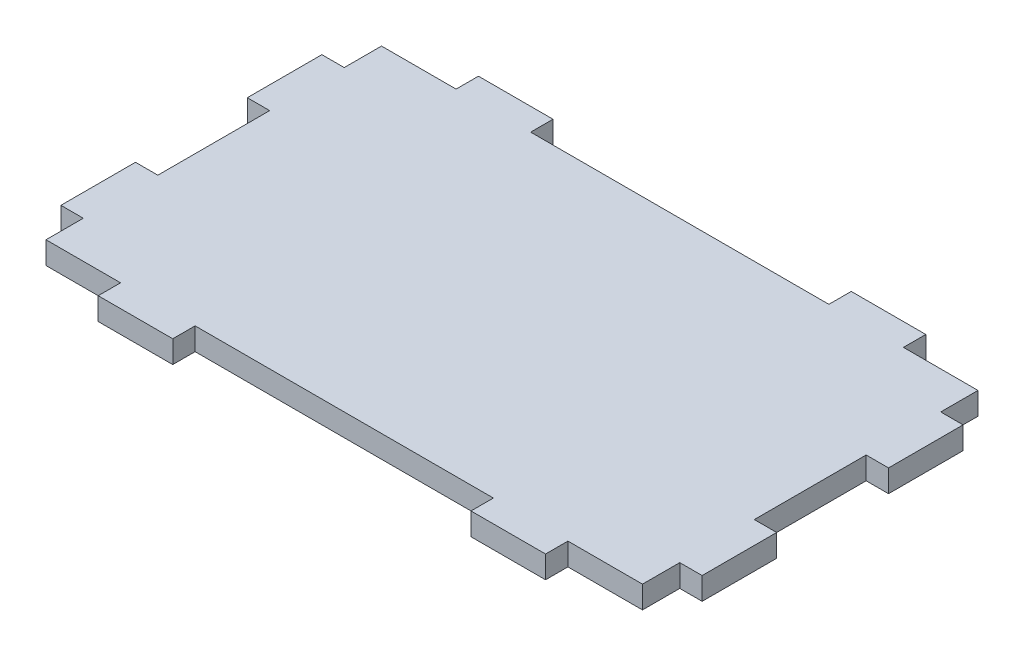
from build123d import *

# Parameters (mm, degrees)
BOSS_EXTRUDE1_DEPTH = 3


with BuildPart() as part:
    # Sketch1 → Boss-Extrude1 (new body)
    with BuildSketch(Plane(origin=(0, 0, 0), x_dir=(1, 0, 0), z_dir=(0, 1, 0))):
        Polygon((0, 0), (10, 0), (10, -3), (20, -3), (20, 0), (60, 0), (60, -3), (70, -3), (70, 0), (80, 0), (80, 5), (83, 5), (83, 15), (80, 15), (80, 30), (83, 30), (83, 40), (80, 40), (80, 45), (70, 45), (70, 48), (60, 48), (60, 45), (20, 45), (20, 48), (10, 48), (10, 45), (0, 45), (0, 40), (-3, 40), (-3, 30), (0, 30), (0, 15), (-3, 15), (-3, 5), (0, 5), align=None)
    extrude(amount=BOSS_EXTRUDE1_DEPTH)


solid = part.part
